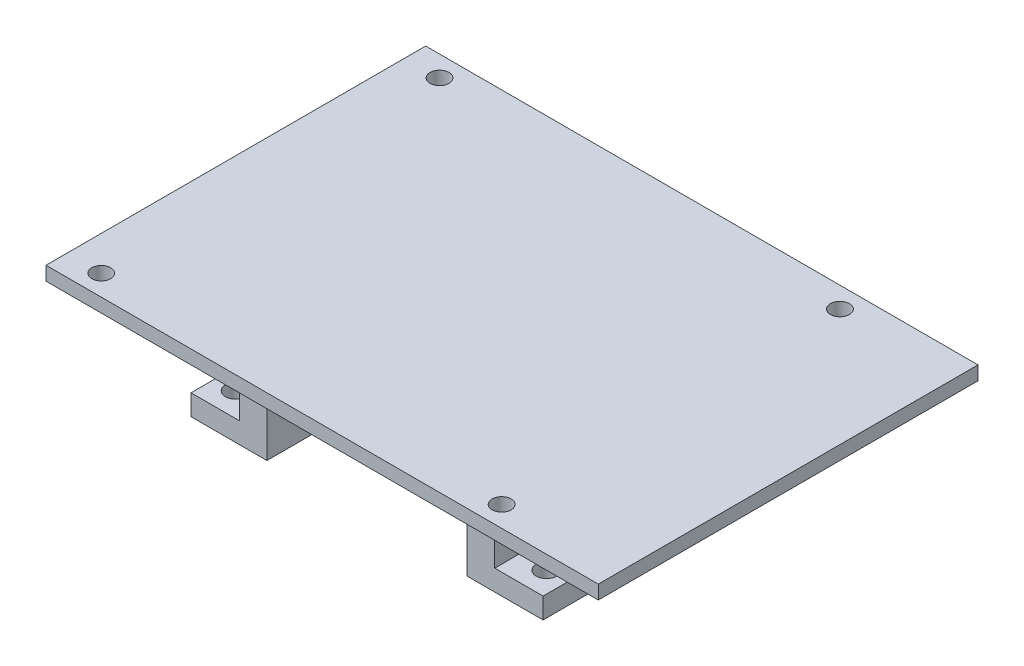
from build123d import *

# Parameters (mm, degrees)
EXTRUDE_1_DEPTH     = 27.5
CUT_EXTRUDE_1_REACH = 52.806
SKETCH_4_R          = 1.5
CUT_EXTRUDE_2_REACH = 52.806
SKETCH_5_W          = 51
SKETCH_5_H          = 6.5
SKETCH_5_H_2        = 28
CUT_EXTRUDE_3_REACH = 52.806
SKETCH_6_R          = 1.375


with BuildPart() as part:
    # 草圖1 → 填料-伸長1 (new, symmetric)
    with BuildSketch(Plane.XY):
        Polygon((-25.5, 0), (-25.5, 3), (-18.5, 3), (-18.5, 13), (-40, 13), (-40, 15), (40, 15), (40, 13), (18.5, 13), (18.5, 3), (25.5, 3), (25.5, 0), (14.5, 0), (14.5, 13), (-14.5, 13), (-14.5, 0), align=None)
    extrude(amount=EXTRUDE_1_DEPTH, both=True)

    # 草圖4 → 除料-伸長1 (cut, up to next)
    with BuildSketch(Plane(origin=(0, 0, 0), x_dir=(-1, 0, 0), z_dir=(0, -1, 0)), mode=Mode.PRIVATE) as cut_extrude_1_sk1:
        with Locations(Location((-22.5, 17.5, 0), (0, 0, 90))):
            Circle(SKETCH_4_R)
    cut_extrude_1_tool1 = extrude(cut_extrude_1_sk1.sketch, amount=-CUT_EXTRUDE_1_REACH, mode=Mode.PRIVATE) & part.part
    # 草圖4 → 除料-伸長1 (cut, up to next)
    with BuildSketch(Plane(origin=(0, 0, 0), x_dir=(-1, 0, 0), z_dir=(0, -1, 0)), mode=Mode.PRIVATE) as cut_extrude_1_sk2:
        with Locations(Location((-22.5, -17.5, 0), (0, 0, 90))):
            Circle(SKETCH_4_R)
    cut_extrude_1_tool2 = extrude(cut_extrude_1_sk2.sketch, amount=-CUT_EXTRUDE_1_REACH, mode=Mode.PRIVATE) & part.part
    # 草圖4 → 除料-伸長1 (cut, up to next)
    with BuildSketch(Plane(origin=(0, 0, 0), x_dir=(-1, 0, 0), z_dir=(0, -1, 0)), mode=Mode.PRIVATE) as cut_extrude_1_sk3:
        with Locations(Location((22.5, -17.5, 0), (0, 0, 90))):
            Circle(SKETCH_4_R)
    cut_extrude_1_tool3 = extrude(cut_extrude_1_sk3.sketch, amount=-CUT_EXTRUDE_1_REACH, mode=Mode.PRIVATE) & part.part
    # 草圖4 → 除料-伸長1 (cut, up to next)
    with BuildSketch(Plane(origin=(0, 0, 0), x_dir=(-1, 0, 0), z_dir=(0, -1, 0)), mode=Mode.PRIVATE) as cut_extrude_1_sk4:
        with Locations(Location((22.5, 17.5, 0), (0, 0, 90))):
            Circle(SKETCH_4_R)
    cut_extrude_1_tool4 = extrude(cut_extrude_1_sk4.sketch, amount=-CUT_EXTRUDE_1_REACH, mode=Mode.PRIVATE) & part.part
    add(cut_extrude_1_tool1.solids().sort_by_distance((22.5, 0, -17.5))[0], mode=Mode.SUBTRACT)
    add(cut_extrude_1_tool2.solids().sort_by_distance((22.5, 0, 17.5))[0], mode=Mode.SUBTRACT)
    add(cut_extrude_1_tool3.solids().sort_by_distance((-22.5, 0, 17.5))[0], mode=Mode.SUBTRACT)
    add(cut_extrude_1_tool4.solids().sort_by_distance((-22.5, 0, -17.5))[0], mode=Mode.SUBTRACT)

    # 除料-伸長2: up to this face of the body (flat: up to its plane)
    cut_extrude_2_end = Plane(part.part.faces().sort_by_distance((0, 13, 0))[0])
    # 草圖5 → 除料-伸長2 (cut, up to the picked face)
    with BuildSketch(Plane(origin=(0, 0, 0), x_dir=(-1, 0, 0), z_dir=(0, -1, 0)), mode=Mode.PRIVATE) as cut_extrude_2_sk1:
        with Locations((0, 24.25)):
            Rectangle(SKETCH_5_W, SKETCH_5_H)
    cut_extrude_2_tool1 = split(extrude(cut_extrude_2_sk1.sketch, amount=-CUT_EXTRUDE_2_REACH, mode=Mode.PRIVATE), bisect_by=cut_extrude_2_end, keep=Keep.BOTH, mode=Mode.PRIVATE)
    # 草圖5 → 除料-伸長2 (cut, up to the picked face)
    with BuildSketch(Plane(origin=(0, 0, 0), x_dir=(-1, 0, 0), z_dir=(0, -1, 0)), mode=Mode.PRIVATE) as cut_extrude_2_sk2:
        Rectangle(SKETCH_5_W, SKETCH_5_H_2)
    cut_extrude_2_tool2 = split(extrude(cut_extrude_2_sk2.sketch, amount=-CUT_EXTRUDE_2_REACH, mode=Mode.PRIVATE), bisect_by=cut_extrude_2_end, keep=Keep.BOTH, mode=Mode.PRIVATE)
    # 草圖5 → 除料-伸長2 (cut, up to the picked face)
    with BuildSketch(Plane(origin=(0, 0, 0), x_dir=(-1, 0, 0), z_dir=(0, -1, 0)), mode=Mode.PRIVATE) as cut_extrude_2_sk3:
        with Locations((0, -24.25)):
            Rectangle(SKETCH_5_W, SKETCH_5_H)
    cut_extrude_2_tool3 = split(extrude(cut_extrude_2_sk3.sketch, amount=-CUT_EXTRUDE_2_REACH, mode=Mode.PRIVATE), bisect_by=cut_extrude_2_end, keep=Keep.BOTH, mode=Mode.PRIVATE)
    add(cut_extrude_2_tool1.solids().sort_by(Axis((0, 0, -24.25), (0, 1, 0)))[0], mode=Mode.SUBTRACT)
    add(cut_extrude_2_tool2.solids().sort_by(Axis((0, 0, 0), (0, 1, 0)))[0], mode=Mode.SUBTRACT)
    add(cut_extrude_2_tool3.solids().sort_by(Axis((0, 0, 24.25), (0, 1, 0)))[0], mode=Mode.SUBTRACT)

    # 草圖6 → 除料-伸長3 (cut, up to next)
    with BuildSketch(Plane(origin=(0, 15, 0), x_dir=(1, 0, 0), z_dir=(0, 1, 0)), mode=Mode.PRIVATE) as cut_extrude_3_sk1:
        with Locations(Location((-35, 24.5, 0), (0, 0, 270))):
            Circle(SKETCH_6_R)
    cut_extrude_3_tool1 = extrude(cut_extrude_3_sk1.sketch, amount=-CUT_EXTRUDE_3_REACH, mode=Mode.PRIVATE) & part.part
    # 草圖6 → 除料-伸長3 (cut, up to next)
    with BuildSketch(Plane(origin=(0, 15, 0), x_dir=(1, 0, 0), z_dir=(0, 1, 0)), mode=Mode.PRIVATE) as cut_extrude_3_sk2:
        with Locations(Location((-35, -24.5, 0), (0, 0, 270))):
            Circle(SKETCH_6_R)
    cut_extrude_3_tool2 = extrude(cut_extrude_3_sk2.sketch, amount=-CUT_EXTRUDE_3_REACH, mode=Mode.PRIVATE) & part.part
    # 草圖6 → 除料-伸長3 (cut, up to next)
    with BuildSketch(Plane(origin=(0, 15, 0), x_dir=(1, 0, 0), z_dir=(0, 1, 0)), mode=Mode.PRIVATE) as cut_extrude_3_sk3:
        with Locations(Location((23, -24.5, 0), (0, 0, 270))):
            Circle(SKETCH_6_R)
    cut_extrude_3_tool3 = extrude(cut_extrude_3_sk3.sketch, amount=-CUT_EXTRUDE_3_REACH, mode=Mode.PRIVATE) & part.part
    # 草圖6 → 除料-伸長3 (cut, up to next)
    with BuildSketch(Plane(origin=(0, 15, 0), x_dir=(1, 0, 0), z_dir=(0, 1, 0)), mode=Mode.PRIVATE) as cut_extrude_3_sk4:
        with Locations(Location((23, 24.5, 0), (0, 0, 270))):
            Circle(SKETCH_6_R)
    cut_extrude_3_tool4 = extrude(cut_extrude_3_sk4.sketch, amount=-CUT_EXTRUDE_3_REACH, mode=Mode.PRIVATE) & part.part
    add(cut_extrude_3_tool1.solids().sort_by_distance((-35, 15, -24.5))[0], mode=Mode.SUBTRACT)
    add(cut_extrude_3_tool2.solids().sort_by_distance((-35, 15, 24.5))[0], mode=Mode.SUBTRACT)
    add(cut_extrude_3_tool3.solids().sort_by_distance((23, 15, 24.5))[0], mode=Mode.SUBTRACT)
    add(cut_extrude_3_tool4.solids().sort_by_distance((23, 15, -24.5))[0], mode=Mode.SUBTRACT)


solid = part.part
